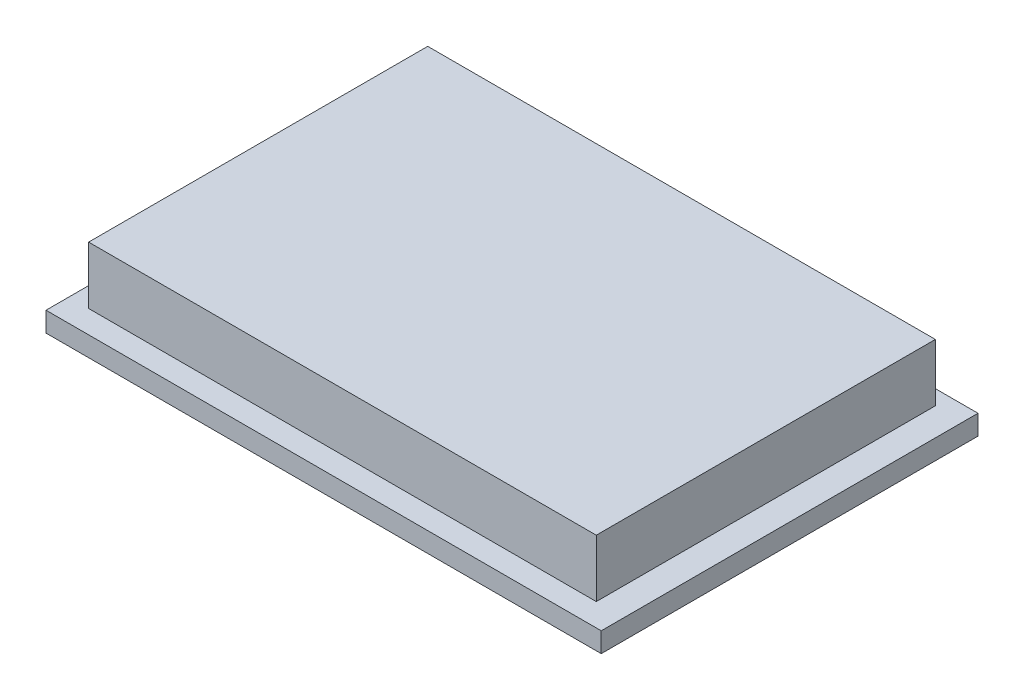
from build123d import *

# Parameters (mm, degrees)
SKETCH1_W           = 128
SKETCH1_H           = 85.5
BOSS_EXTRUDE1_DEPTH = 14.5
SKETCH3_W           = 140
SKETCH3_H           = 95
BOSS_EXTRUDE3_DEPTH = 5


with BuildPart() as part:
    # Sketch1 → Boss-Extrude1 (new body)
    with BuildSketch(Plane(origin=(0, 0, 0), x_dir=(1, 0, 0), z_dir=(0, 1, 0))):
        Rectangle(SKETCH1_W, SKETCH1_H)
    extrude(amount=BOSS_EXTRUDE1_DEPTH)


with BuildPart() as body_2:
    # Sketch3 → Boss-Extrude3 (new body)
    with BuildSketch(Plane.XZ.offset(1)):
        Rectangle(SKETCH3_W, SKETCH3_H)
    extrude(amount=BOSS_EXTRUDE3_DEPTH)


solid = Compound([part.part, body_2.part])
